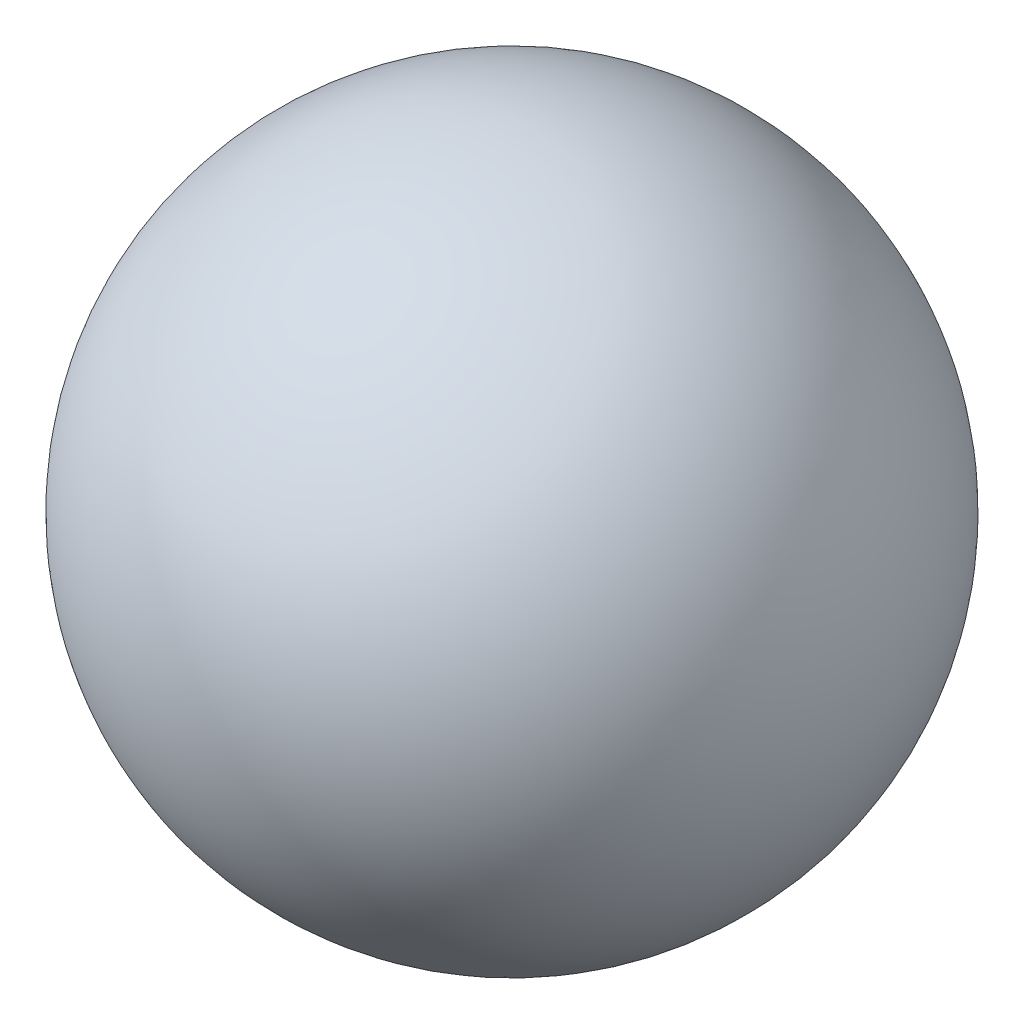
from build123d import *


with BuildPart() as part:
    # Sketch1 → Revolve1 (revolve)
    with BuildSketch(Plane(origin=(0, 0, 0), x_dir=(1, 0, 0), z_dir=(0, 1, 0))):
        with BuildLine():
            Line((0, 119.25427), (0, -119.25427))
            ThreePointArc((0, -119.25427), (119.25427, 0), (0, 119.25427))
        make_face()
    revolve(axis=Axis((0, 0, -119.25427), (0, 0, 1)))


solid = part.part
